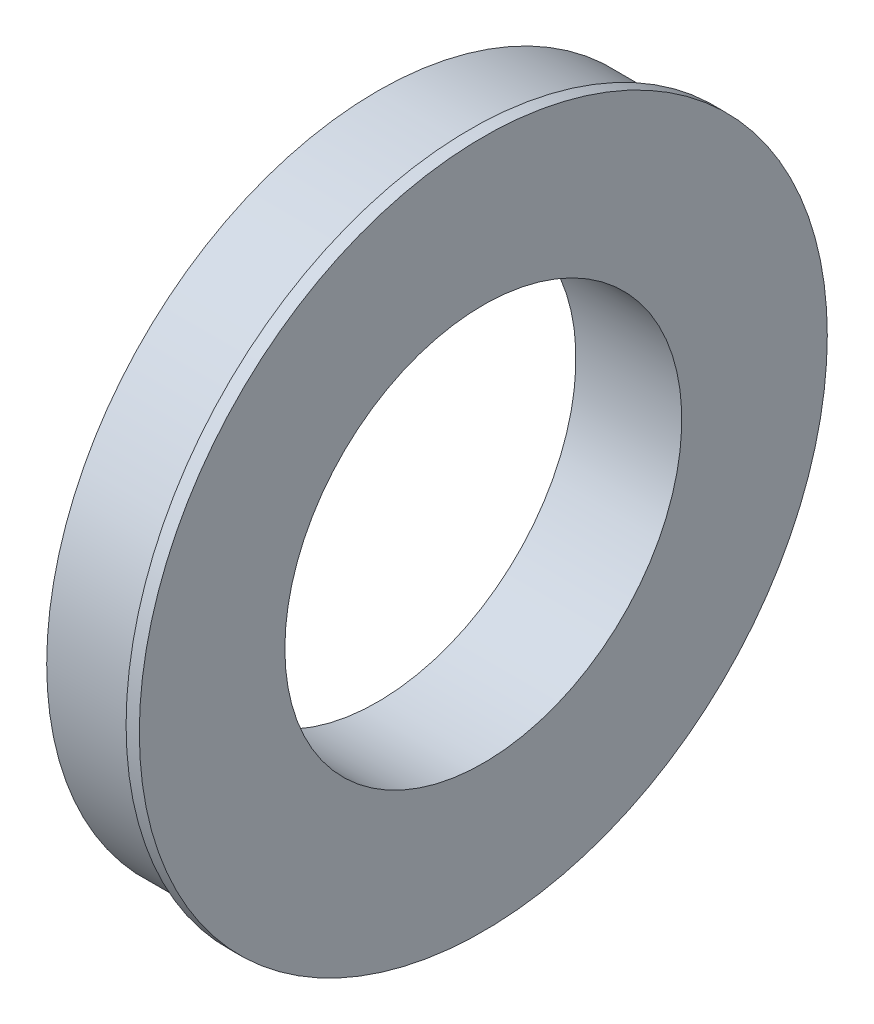
from build123d import *

# Parameters (mm, degrees)
SKETCH1_R           = 63.5
SKETCH1_R_2         = 38.1
BOSS_EXTRUDE1_DEPTH = 9.525
SKETCH2_R           = 66.04
SKETCH2_R_2         = 63.5
SKETCH2_R_3         = 38.1
BOSS_EXTRUDE2_DEPTH = 1.27
SKETCH4_R           = 38.1
CUT_EXTRUDE1_DEPTH  = 96.072033743


with BuildPart() as part:
    # Sketch1 → Boss-Extrude1 (new, symmetric)
    with BuildSketch(Plane(origin=(0, 0, 0), x_dir=(0, 0, -1), z_dir=(1, 0, 0))):
        with Locations(Location((0, 0, 0), (0, 0, 180))):
            Circle(SKETCH1_R)
        with Locations(Location((0, 0, 0), (0, 0, 180))):
            Circle(SKETCH1_R_2, mode=Mode.SUBTRACT)
    extrude(amount=BOSS_EXTRUDE1_DEPTH, both=True)

    # Sketch2 → Boss-Extrude2 (add, symmetric)
    # profile 1 of 4: a face of its own
    with BuildSketch(Plane(origin=(9.525, 0, 0), x_dir=(0, 0, -1), z_dir=(1, 0, 0))):
        Circle(SKETCH2_R)
        with Locations(Location((0, 0, 0), (0, 0, 180))):
            Circle(SKETCH2_R_2, mode=Mode.SUBTRACT)
    # profile 2 of 4: a face of its own
    with BuildSketch(Plane(origin=(9.525, 0, 0), x_dir=(0, 0, -1), z_dir=(1, 0, 0))):
        with Locations(Location((0, 0, 0), (0, 0, 180))):
            Circle(SKETCH2_R_2)
        with Locations(Location((0, 0, 0), (0, 0, 180))):
            Circle(SKETCH2_R_3, mode=Mode.SUBTRACT)
    # profile 3 of 4: a face of its own
    with BuildSketch(Plane(origin=(9.525, 0, 0), x_dir=(0, 0, -1), z_dir=(1, 0, 0))):
        with Locations(Location((0, 0, 0), (0, 0, 180))):
            Circle(SKETCH2_R_3)
    # profile 4 of 4: a face of its own
    with BuildSketch(Plane(origin=(9.525, 0, 0), x_dir=(0, 0, -1), z_dir=(1, 0, 0))):
        with Locations(Location((0, 0, 0), (0, 0, 180))):
            Circle(SKETCH2_R_2)
    extrude(amount=BOSS_EXTRUDE2_DEPTH, both=True)

    # Sketch4 → Cut-Extrude1 (cut, through all)
    with BuildSketch(Plane.ZY.offset(-8.255)):
        Circle(SKETCH4_R)
    extrude(amount=-CUT_EXTRUDE1_DEPTH, mode=Mode.SUBTRACT)


solid = part.part
